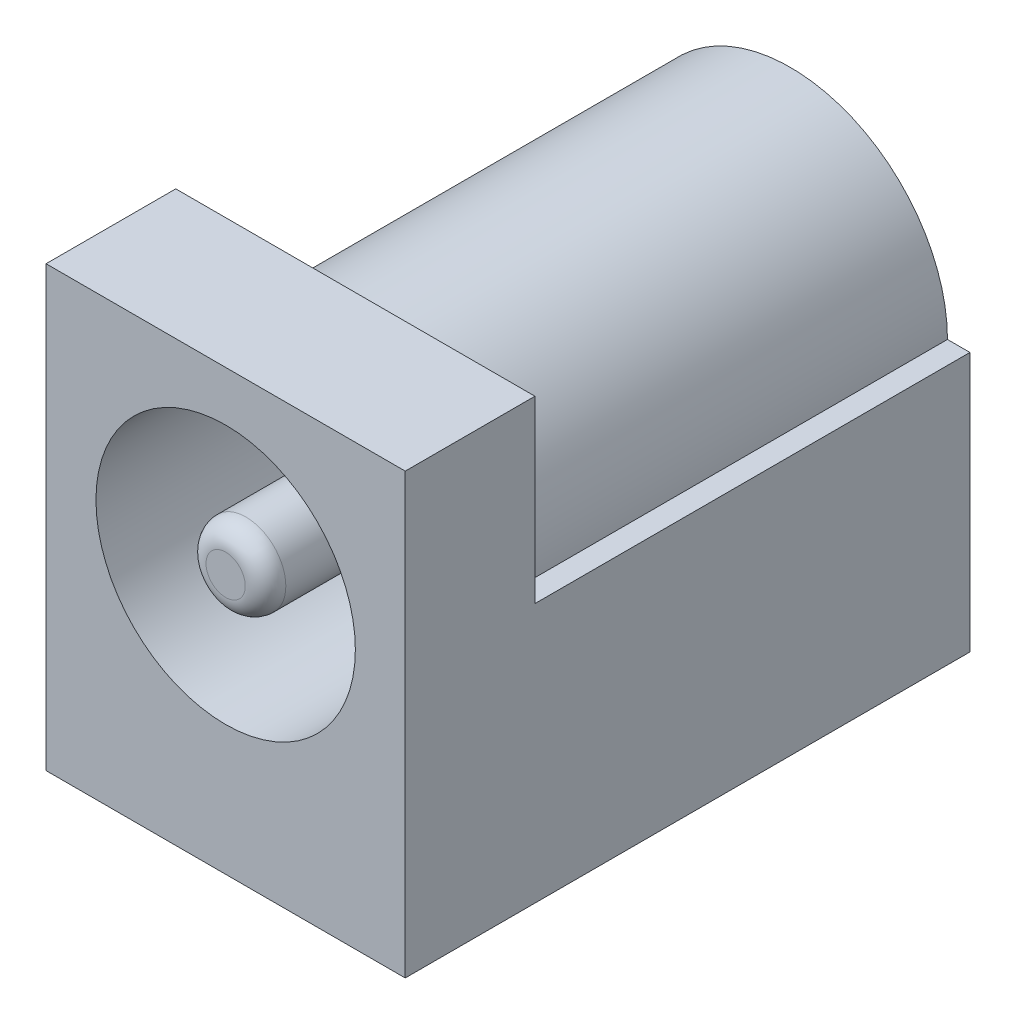
from build123d import *

# Parameters (mm, degrees)
SKETCH2_W           = 9
SKETCH2_H           = 11
BOSS_EXTRUDE1_DEPTH = 3.25
BOSS_EXTRUDE2_DEPTH = 10.9
SKETCH4_R           = 3.25
SKETCH4_R_2         = 1
CUT_EXTRUDE1_DEPTH  = 10.9
FILLET1_R           = 0.508


with BuildPart() as part:
    # Sketch2 → Boss-Extrude1 (new body)
    with BuildSketch(Plane.XY):
        Rectangle(SKETCH2_W, SKETCH2_H)
    extrude(amount=BOSS_EXTRUDE1_DEPTH)

    # Sketch3 → Boss-Extrude2 (add)
    with BuildSketch(Plane(origin=(0, 0, 0), x_dir=(-1, 0, 0), z_dir=(0, 0, -1))):
        with BuildLine():
            Line((-4.5, 1), (-3.937, 1))
            ThreePointArc((-3.937, 1), (0, 4.937), (3.937, 1))
            Line((3.937, 1), (4.5, 1))
            Line((4.5, 1), (4.5, -5.5))
            Line((4.5, -5.5), (-4.5, -5.5))
            Line((-4.5, -5.5), (-4.5, 1))
        make_face()
    extrude(amount=BOSS_EXTRUDE2_DEPTH)

    # Sketch4 → Cut-Extrude1 (cut)
    with BuildSketch(Plane.XY.offset(3.25)):
        with Locations((0, 1)):
            Circle(SKETCH4_R)
        with Locations((0, 1)):
            Circle(SKETCH4_R_2, mode=Mode.SUBTRACT)
    extrude(amount=-CUT_EXTRUDE1_DEPTH, mode=Mode.SUBTRACT)

    # Fillet1
    fillet1_edges = [part.edges().sort_by_distance(p)[0] for p in [
        (-1, 1, 3.25),
    ]]
    fillet(fillet1_edges, radius=FILLET1_R)


solid = part.part
